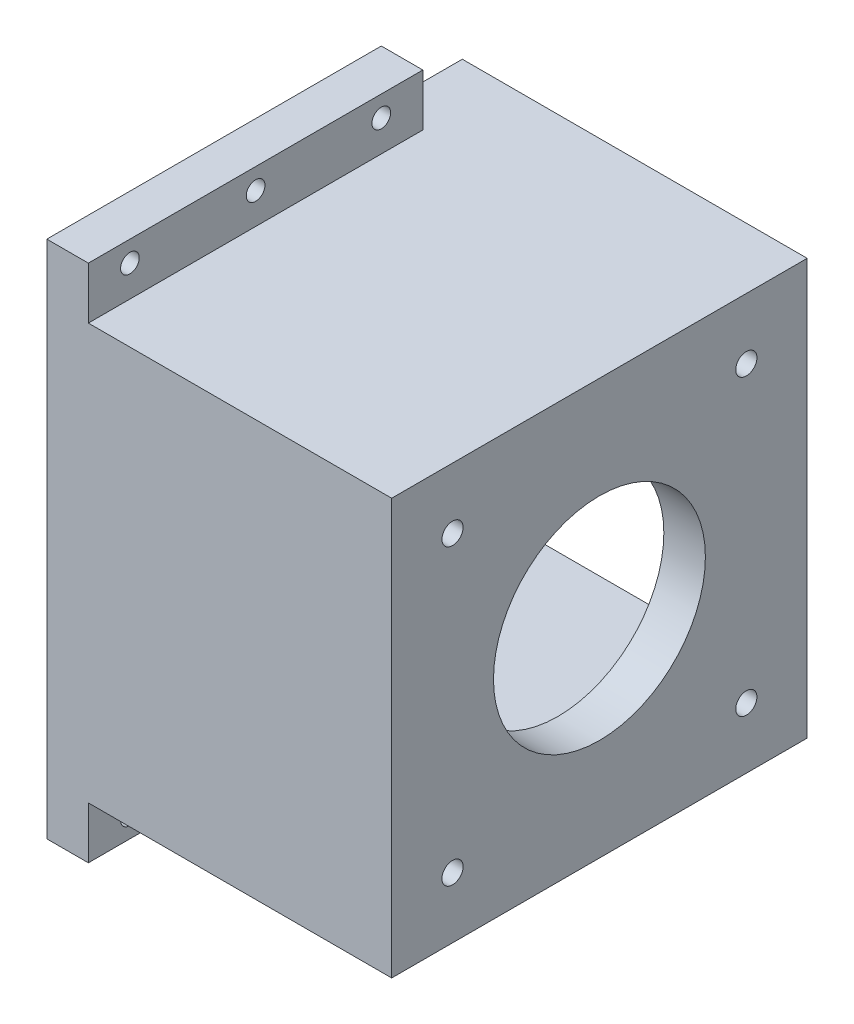
from build123d import *

# Parameters (mm, degrees)
EXTRUDE_1_DEPTH          = 200
SKETCH_2_W               = 39
SKETCH_2_H               = 25
CUT_EXTRUDE_1_DEPTH      = 20
SKETCH_3_W               = 126
SKETCH_3_H               = 160
CUT_EXTRUDE_2_DEPTH      = 180
CUT_EXTRUDE_3_REACH      = 362.633
SKETCH_4_R               = 51
SKETCH_5_R               = 25.5
CUT_EXTRUDE_4_DEPTH      = 15
SKETCH_6_R               = 57.15
CUT_EXTRUDE_5_DEPTH      = 5
CUT_EXTRUDE_6_REACH      = 353.875
SKETCH_7_R               = 4.5
PATTERN_CIRCULAR_1_COUNT = 4


with BuildPart() as part:
    # 草图1 → 凸台-拉伸1 (new body)
    with BuildSketch(Plane.XY):
        Polygon((20, 225), (20, 250), (0, 250), (0, 0), (20, 0), (20, 25), (166, 25), (166, 225), align=None)
    extrude(amount=-EXTRUDE_1_DEPTH)

    # 草图2 → 切除-拉伸1 (cut)
    with BuildSketch(Plane.ZY):
        with Locations((-180.5, 237.5)):
            Rectangle(SKETCH_2_W, SKETCH_2_H)
        with Locations((-180.5, 12.5)):
            Rectangle(SKETCH_2_W, SKETCH_2_H)
    extrude(amount=-CUT_EXTRUDE_1_DEPTH, mode=Mode.SUBTRACT)

    # 草图3 → 切除-拉伸2 (cut)
    with BuildSketch(Plane(origin=(0, 0, -200), x_dir=(-1, 0, 0), z_dir=(0, 0, -1))):
        with Locations((-83, 122.583335177)):
            Rectangle(SKETCH_3_W, SKETCH_3_H)
    extrude(amount=-CUT_EXTRUDE_2_DEPTH, mode=Mode.SUBTRACT)

    # 草图4 → 切除-拉伸3 (cut, up to next)
    with BuildSketch(Plane(origin=(166, 0, 0), x_dir=(0, 0, -1), z_dir=(1, 0, 0)), mode=Mode.PRIVATE) as cut_extrude_3_sk1:
        with Locations((100, 125)):
            Circle(SKETCH_4_R)
    cut_extrude_3_tool1 = extrude(cut_extrude_3_sk1.sketch, amount=-CUT_EXTRUDE_3_REACH, mode=Mode.PRIVATE) & part.part
    add(cut_extrude_3_tool1.solids().sort_by_distance((166, 125, -100))[0], mode=Mode.SUBTRACT)

    # 草图5 → 切除-拉伸4 (cut)
    with BuildSketch(Plane(origin=(20, 0, 0), x_dir=(0, 0, -1), z_dir=(1, 0, 0))):
        with Locations(Location((100, 125, 0), (0, 0, 90))):
            Circle(SKETCH_5_R)
    extrude(amount=-CUT_EXTRUDE_4_DEPTH, mode=Mode.SUBTRACT)

    # 草图6 → 切除-拉伸5 (cut)
    with BuildSketch(Plane.ZY):
        with Locations((-100, 125)):
            Circle(SKETCH_6_R)
    extrude(amount=-CUT_EXTRUDE_5_DEPTH, mode=Mode.SUBTRACT)

    # 草图7 → 切除-拉伸6 (cut, up to next)
    with BuildSketch(Plane(origin=(20, 0, 0), x_dir=(0, 0, -1), z_dir=(1, 0, 0)), mode=Mode.PRIVATE) as cut_extrude_6_sk1:
        with Locations(Location((20, 240, 0), (0, 0, 90))):
            Circle(SKETCH_7_R)
    cut_extrude_6_tool1 = extrude(cut_extrude_6_sk1.sketch, amount=-CUT_EXTRUDE_6_REACH, mode=Mode.PRIVATE) & part.part
    # 草图7 → 切除-拉伸6 (cut, up to next)
    with BuildSketch(Plane(origin=(20, 0, 0), x_dir=(0, 0, -1), z_dir=(1, 0, 0)), mode=Mode.PRIVATE) as cut_extrude_6_sk2:
        with Locations(Location((80.5, 240, 0), (0, 0, 90))):
            Circle(SKETCH_7_R)
    cut_extrude_6_tool2 = extrude(cut_extrude_6_sk2.sketch, amount=-CUT_EXTRUDE_6_REACH, mode=Mode.PRIVATE) & part.part
    # 草图7 → 切除-拉伸6 (cut, up to next)
    with BuildSketch(Plane(origin=(20, 0, 0), x_dir=(0, 0, -1), z_dir=(1, 0, 0)), mode=Mode.PRIVATE) as cut_extrude_6_sk3:
        with Locations(Location((141, 240, 0), (0, 0, 90))):
            Circle(SKETCH_7_R)
    cut_extrude_6_tool3 = extrude(cut_extrude_6_sk3.sketch, amount=-CUT_EXTRUDE_6_REACH, mode=Mode.PRIVATE) & part.part
    # 草图7 → 切除-拉伸6 (cut, up to next)
    with BuildSketch(Plane(origin=(20, 0, 0), x_dir=(0, 0, -1), z_dir=(1, 0, 0)), mode=Mode.PRIVATE) as cut_extrude_6_sk4:
        with Locations(Location((141, 10, 0), (0, 0, 180))):
            Circle(SKETCH_7_R)
    cut_extrude_6_tool4 = extrude(cut_extrude_6_sk4.sketch, amount=-CUT_EXTRUDE_6_REACH, mode=Mode.PRIVATE) & part.part
    # 草图7 → 切除-拉伸6 (cut, up to next)
    with BuildSketch(Plane(origin=(20, 0, 0), x_dir=(0, 0, -1), z_dir=(1, 0, 0)), mode=Mode.PRIVATE) as cut_extrude_6_sk5:
        with Locations(Location((80.5, 10, 0), (0, 0, 180))):
            Circle(SKETCH_7_R)
    cut_extrude_6_tool5 = extrude(cut_extrude_6_sk5.sketch, amount=-CUT_EXTRUDE_6_REACH, mode=Mode.PRIVATE) & part.part
    # 草图7 → 切除-拉伸6 (cut, up to next)
    with BuildSketch(Plane(origin=(20, 0, 0), x_dir=(0, 0, -1), z_dir=(1, 0, 0)), mode=Mode.PRIVATE) as cut_extrude_6_sk6:
        with Locations(Location((20, 10, 0), (0, 0, 180))):
            Circle(SKETCH_7_R)
    cut_extrude_6_tool6 = extrude(cut_extrude_6_sk6.sketch, amount=-CUT_EXTRUDE_6_REACH, mode=Mode.PRIVATE) & part.part
    add(cut_extrude_6_tool1.solids().sort_by_distance((20, 240, -20))[0], mode=Mode.SUBTRACT)
    add(cut_extrude_6_tool2.solids().sort_by_distance((20, 240, -80.5))[0], mode=Mode.SUBTRACT)
    add(cut_extrude_6_tool3.solids().sort_by_distance((20, 240, -141))[0], mode=Mode.SUBTRACT)
    add(cut_extrude_6_tool4.solids().sort_by_distance((20, 10, -141))[0], mode=Mode.SUBTRACT)
    add(cut_extrude_6_tool5.solids().sort_by_distance((20, 10, -80.5))[0], mode=Mode.SUBTRACT)
    add(cut_extrude_6_tool6.solids().sort_by_distance((20, 10, -20))[0], mode=Mode.SUBTRACT)

    # 草图9 → M12 螺纹孔1 (revolve, cut)
    with BuildSketch(Plane(origin=(166, 195.711356231, -170.71), x_dir=(0, 0, -1), z_dir=(0, 1, 0))):
        Polygon((0, 0), (0, 29.25), (5.1, 26.185610843), (5.1, 0), align=None)
    hole_wizard_m12_1 = revolve(axis=Axis((172.35, 195.711356231, -170.71), (-1, 0, 0)), mode=Mode.SUBTRACT)

    # 阵列(圆周)1: M12 螺纹孔1 ×4 about axis
    pattern_circular_1_axis = Axis((0, 125, -100), (1, 0, 0))
    for i in range(1, PATTERN_CIRCULAR_1_COUNT):
        add(hole_wizard_m12_1.rotate(pattern_circular_1_axis, i * 360 / PATTERN_CIRCULAR_1_COUNT), mode=Mode.SUBTRACT)


solid = part.part
